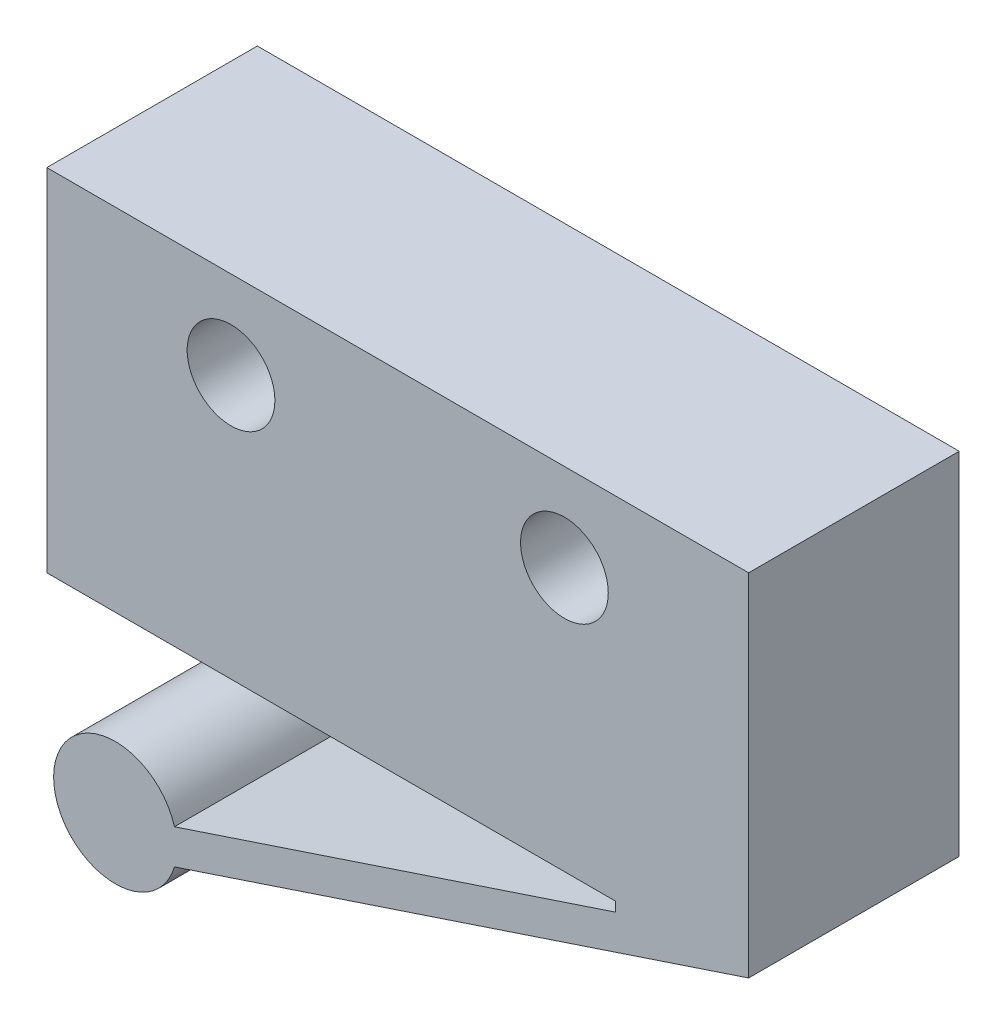
from build123d import *

# Parameters (mm, degrees)
ESQUISSE1_R        = 1.25
BOSS_EXTRU_1_DEPTH = 6


with BuildPart() as part:
    # Esquisse1 → Boss.-Extru.1 (new body)
    with BuildSketch(Plane.XY):
        with BuildLine():
            Line((0, 0), (-20, 0))
            Line((-20, 0), (-20, -10))
            Line((-20, -10), (-3.793153891, -10))
            Line((-3.793153891, -10), (-3.793153891, -10.2709826))
            Line((-3.793153891, -10.2709826), (-16.361734821, -14.448666512))
            ThreePointArc((-16.361734821, -14.448666512), (-19.805755597, -14.942812593), (-16.361966598, -15.438571387))
            Line((-16.361966598, -15.438571387), (0, -10))
            Line((0, -10), (0, 0))
        make_face()
        with Locations((-14.75, -2.5)):
            Circle(ESQUISSE1_R, mode=Mode.SUBTRACT)
        with Locations((-5.25, -2.5)):
            Circle(ESQUISSE1_R, mode=Mode.SUBTRACT)
    extrude(amount=BOSS_EXTRU_1_DEPTH)


solid = part.part
